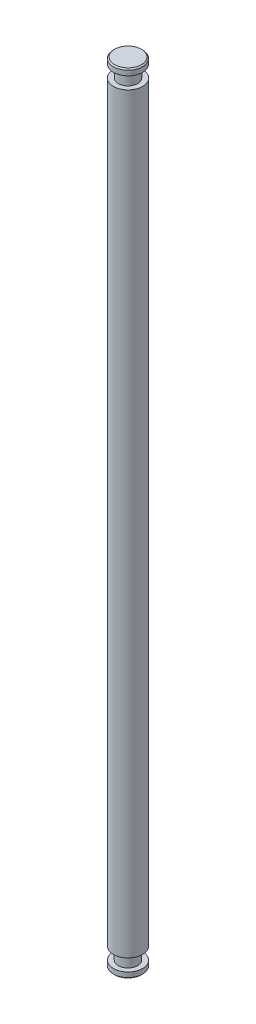
from build123d import *

# Parameters (mm, degrees)
ESBO_O2_R                = 6
RESSALTO_EXTRUS_O1_DEPTH = 324
CHANFRO1_SIZE            = 0.5
ESBO_O3_R                = 6
ESBO_O3_R_2              = 4
CORTE_EXTRUS_O1_DEPTH    = 2.5
ESBO_O4_R                = 6
ESBO_O4_R_2              = 4
CORTE_EXTRUS_O2_DEPTH    = 2.5


with BuildPart() as part:
    # Esboço2 → Ressalto-extrusão1 (new body)
    with BuildSketch(Plane(origin=(0, 0, 0), x_dir=(1, 0, 0), z_dir=(0, 1, 0))):
        with Locations(Location((0, 0, 0), (0, 0, 270))):
            Circle(ESBO_O2_R)
    extrude(amount=RESSALTO_EXTRUS_O1_DEPTH)

    # Chanfro1
    chanfro1_edges = [part.edges().sort_by_distance(p)[0] for p in [
        (0, 0, -6),
        (0, 324, -6),
    ]]
    chamfer(chanfro1_edges, length=CHANFRO1_SIZE)

    # Esboço3 → Corte-extrusão1 (cut, symmetric)
    with BuildSketch(Plane(origin=(0, 5, 0), x_dir=(-1, 0, 0), z_dir=(0, -1, 0))):
        with Locations(Location((0, 0, 0), (0, 0, 90))):
            Circle(ESBO_O3_R)
        with Locations(Location((0, 0, 0), (0, 0, 90))):
            Circle(ESBO_O3_R_2, mode=Mode.SUBTRACT)
    extrude(amount=CORTE_EXTRUS_O1_DEPTH, both=True, mode=Mode.SUBTRACT)

    # Esboço4 → Corte-extrusão2 (cut, symmetric)
    with BuildSketch(Plane(origin=(0, 319, 0), x_dir=(1, 0, 0), z_dir=(0, 1, 0))):
        with Locations(Location((0, 0, 0), (0, 0, 90))):
            Circle(ESBO_O4_R)
        with Locations(Location((0, 0, 0), (0, 0, 90))):
            Circle(ESBO_O4_R_2, mode=Mode.SUBTRACT)
    extrude(amount=CORTE_EXTRUS_O2_DEPTH, both=True, mode=Mode.SUBTRACT)


solid = part.part
